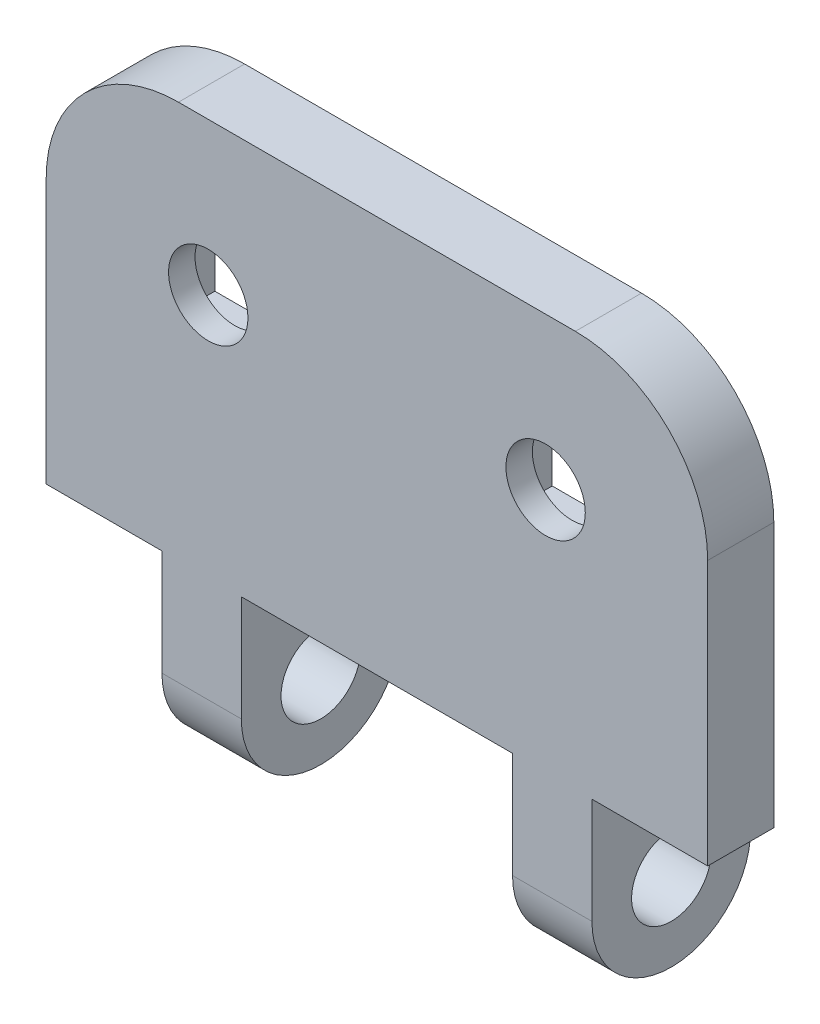
from build123d import *
from build123d.topology import SkipClean

# Parameters (mm, degrees)
SALIENTE_EXTRUIR1_DEPTH    = 5
CROQUIS4_W                 = 6
CROQUIS4_H                 = 13
SALIENTE_EXTRUIR2_DEPTH    = 5
SALIENTE_EXTRUIR3_REACH    = 52.106
CROQUIS6_R                 = 6
CROQUIS6_R_2               = 3
CORTAR_EXTRUIR1_DEPTH      = 51.907391408
CORTAR_EXTRUIR1_DEPTH_BACK = 51.907391408
CORTAR_EXTRUIR2_DEPTH      = 39.923000912
CORTAR_EXTRUIR2_DEPTH_BACK = 39.923000912
CROQUIS8_W                 = 20.5
CROQUIS8_H                 = 15.513520957
CROQUIS9_R                 = 3
CORTAR_EXTRUIR3_DEPTH      = 6
CROQUIS10_W                = 9
CROQUIS10_H                = 9
CORTAR_EXTRUIR4_DEPTH      = 3


with BuildPart() as part:
    # Croquis1 → Saliente-Extruir1 (new body)
    with BuildSketch(Plane.XY):
        with BuildLine():
            Line((15, 15), (-15, 15))
            ThreePointArc((-15, 15), (-22.071067812, 12.071067812), (-25, 5))
            Line((-25, 5), (-25, -15))
            Line((-25, -15), (25, -15))
            Line((25, -15), (25, 5))
            ThreePointArc((25, 5), (22.071067812, 12.071067812), (15, 15))
        make_face()
    extrude(amount=SALIENTE_EXTRUIR1_DEPTH)

    # Croquis4 → Saliente-Extruir2 (add)
    with BuildSketch(Plane.XY.offset(5)):
        with Locations((-13.25, -21.5)):
            Rectangle(CROQUIS4_W, CROQUIS4_H)
        with Locations((13.25, -21.5)):
            Rectangle(CROQUIS4_W, CROQUIS4_H)
    extrude(amount=-SALIENTE_EXTRUIR2_DEPTH)

    # Saliente-Extruir3: up to this face of the body (flat: up to its plane)
    saliente_extruir3_end = Plane(part.part.faces().sort_by_distance((-16.25, -21.5, 2.5))[0])
    # Croquis6 → Saliente-Extruir3 (add, up to the picked face)
    with BuildSketch(Plane(origin=(16.25, 0, 0), x_dir=(0, 0, -1), z_dir=(1, 0, 0)), mode=Mode.PRIVATE) as saliente_extruir3_sk1:
        with Locations(Location((1, -23, 0), (0, 0, 99.594068227))):
            Circle(CROQUIS6_R)
        with Locations(Location((1, -23, 0), (0, 0, 109.471220634))):
            Circle(CROQUIS6_R_2, mode=Mode.SUBTRACT)
    saliente_extruir3_tool1 = split(extrude(saliente_extruir3_sk1.sketch, amount=-SALIENTE_EXTRUIR3_REACH, mode=Mode.PRIVATE), bisect_by=saliente_extruir3_end, keep=Keep.BOTH, mode=Mode.PRIVATE)
    add(saliente_extruir3_tool1.solids().sort_by(Axis((16.25, -28.748748, -1.971716), (-1, 0, 0)))[0])

    # Croquis7 → Cortar-Extruir1 (cut, two sides: drawn at the far end of the back side and taken through both)
    with SkipClean():  # the faces are left unmerged after this step: merging them gives an invalid solid
        with BuildSketch(Plane.ZY.offset(16.25).offset(-CORTAR_EXTRUIR1_DEPTH_BACK)):
            with BuildLine():
                Line((0, -20.171572875), (0, -25.828427125))
                ThreePointArc((0, -25.828427125), (-4, -23), (0, -20.171572875))
            make_face()
            with BuildLine():
                ThreePointArc((0, -25.828427125), (1.449489743, -24.732050808), (2, -23))
                ThreePointArc((2, -23), (1.449489743, -21.267949192), (0, -20.171572875))
                Line((0, -20.171572875), (0, -25.828427125))
            make_face()
            with BuildLine():
                Line((0, -25.828427125), (0, -20.171572875))
                ThreePointArc((0, -20.171572875), (-4, -23), (0, -25.828427125))
            make_face()
            with BuildLine():
                Line((5, -28), (5, -23))
                ThreePointArc((5, -23), (4.286764074, -25.837274331), (2.31662479, -28))
                Line((2.31662479, -28), (5, -28))
            make_face()
        extrude(amount=CORTAR_EXTRUIR1_DEPTH + CORTAR_EXTRUIR1_DEPTH_BACK, mode=Mode.SUBTRACT)

    # Croquis8 → Cortar-Extruir2 (cut, two sides: drawn at the far end of the back side and taken through both)
    with BuildSketch(Plane(origin=(0, 0, 0), x_dir=(-1, 0, 0), z_dir=(0, 0, -1)).offset(-CORTAR_EXTRUIR2_DEPTH_BACK)):
        with Locations((0, -22.756760479)):
            Rectangle(CROQUIS8_W, CROQUIS8_H)
    extrude(amount=CORTAR_EXTRUIR2_DEPTH + CORTAR_EXTRUIR2_DEPTH_BACK, mode=Mode.SUBTRACT)

    # Croquis9 → Cortar-Extruir3 (cut)
    with BuildSketch(Plane.XY.offset(5)):
        with Locations((-12.75, 3.5)):
            Circle(CROQUIS9_R)
        with Locations((12.75, 3.5)):
            Circle(CROQUIS9_R)
    extrude(amount=-CORTAR_EXTRUIR3_DEPTH, mode=Mode.SUBTRACT)

    # Croquis10 → Cortar-Extruir4 (cut)
    with BuildSketch(Plane(origin=(0, 0, 0), x_dir=(-1, 0, 0), z_dir=(0, 0, -1))):
        with Locations((-12.75, 3.5)):
            Rectangle(CROQUIS10_W, CROQUIS10_H)
        with Locations((12.75, 3.5)):
            Rectangle(CROQUIS10_W, CROQUIS10_H)
    extrude(amount=-CORTAR_EXTRUIR4_DEPTH, mode=Mode.SUBTRACT)


solid = part.part
